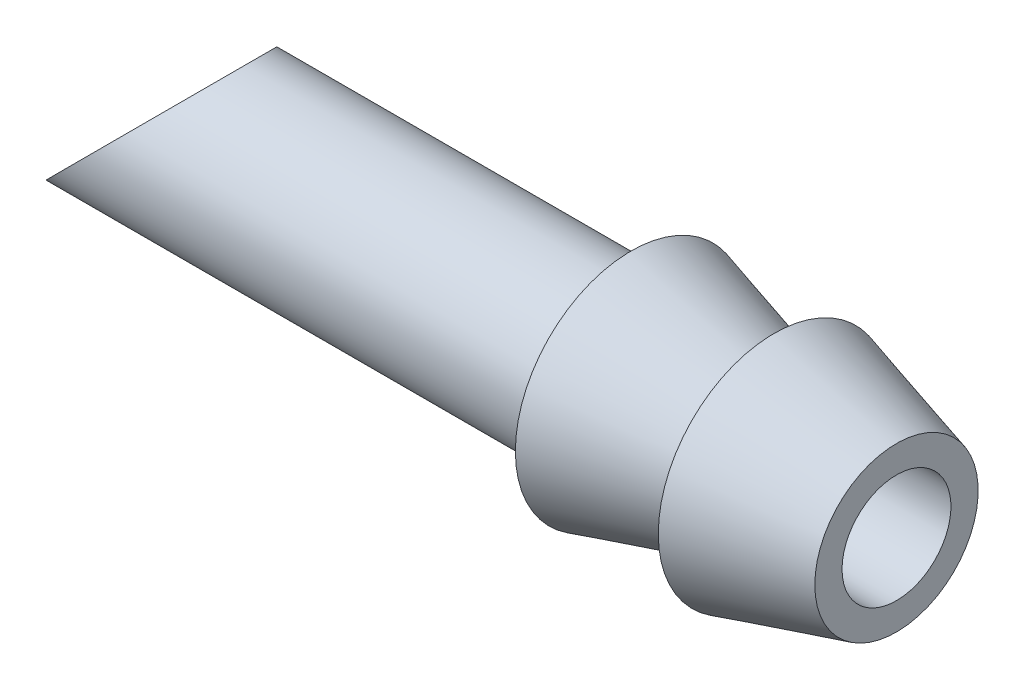
from build123d import *

# Parameters (mm, degrees)
CUT_EXTRUDE1_DEPTH = 5


with BuildPart() as part:
    # Sketch1 → Revolve1 (revolve)
    with BuildSketch(Plane.XY, mode=Mode.PRIVATE) as revolve1_sk:
        Polygon((0, 2), (0, 3), (20.25, 3), (20.25, 4.25), (24.75, 3), (25.5, 3), (25.5, 4.25), (30, 3), (30, 2), align=None)
    revolve(revolve1_sk.sketch.rotate(Axis((0, 0, 0), (1, 0, 0)), 90), axis=Axis((0, 0, 0), (1, 0, 0)))

    # Sketch2 → Cut-Extrude1 (cut, symmetric)
    with BuildSketch(Plane.XY):
        Polygon((0, -3), (6, 3), (0, 3), align=None)
    extrude(amount=CUT_EXTRUDE1_DEPTH, both=True, mode=Mode.SUBTRACT)


solid = part.part
